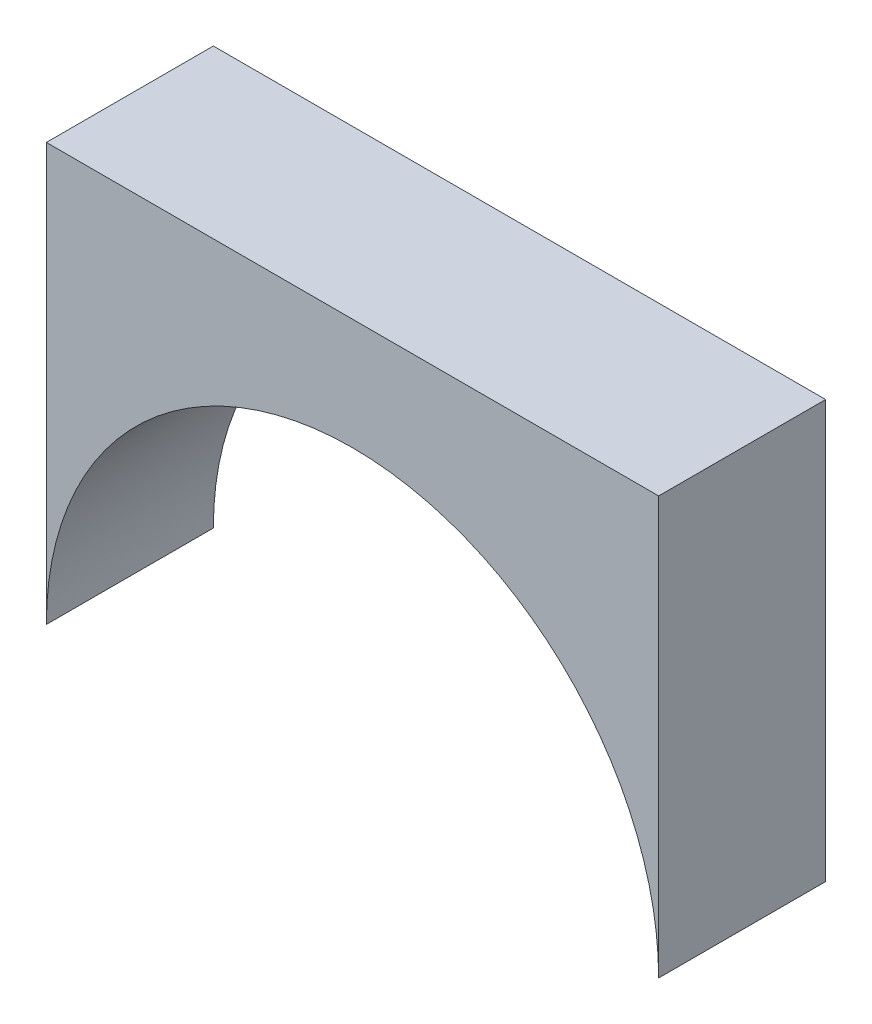
from build123d import *

# Parameters (mm, degrees)
EXTRUDE_1_DEPTH = 3


with BuildPart() as part:
    # 草图1 → 凸台-拉伸1 (new body)
    with BuildSketch(Plane.XY):
        with BuildLine():
            Line((-5.5, 0), (-5.5, 7.5))
            Line((-5.5, 7.5), (5.5, 7.5))
            Line((5.5, 7.5), (5.5, 0))
            ThreePointArc((5.5, 0), (0, 5.5), (-5.5, 0))
        make_face()
    extrude(amount=EXTRUDE_1_DEPTH)


solid = part.part
